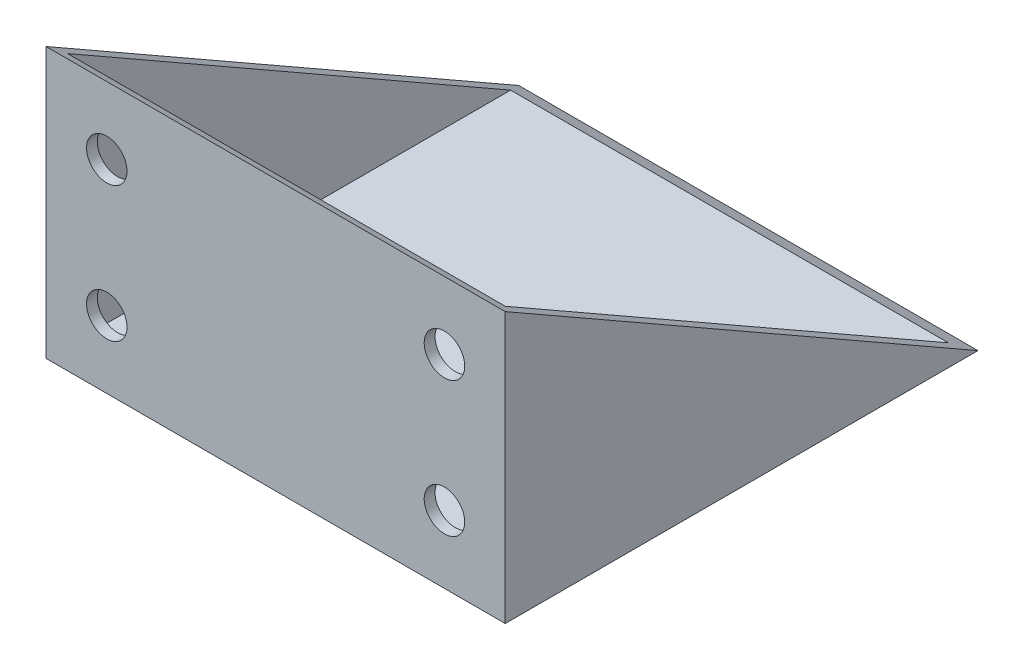
from build123d import *

# Parameters (mm, degrees)
SALIENTE_EXTRUIR3_DEPTH = 34
VACIADO5_T              = -0.8
CROQUIS5_R              = 1.5
CORTAR_EXTRUIR1_DEPTH   = 3


with BuildPart() as part:
    # Croquis4 → Saliente-Extruir3 (new body)
    with BuildSketch(Plane(origin=(0, 0, 0), x_dir=(0, 0, -1), z_dir=(1, 0, 0))):
        Polygon((0, 0), (35, 0), (0, 20), align=None)
    extrude(amount=SALIENTE_EXTRUIR3_DEPTH)

    # Vaciado5
    vaciado5_openings = [part.faces().sort_by_distance(p)[0] for p in [
        (17, 10, -17.5),
    ]]
    offset(amount=VACIADO5_T, openings=vaciado5_openings, kind=Kind.INTERSECTION)

    # Croquis5 → Cortar-Extruir1 (cut)
    with BuildSketch(Plane.XY):
        with Locations((4.5, 15)):
            Circle(CROQUIS5_R)
        with Locations((29.5, 15)):
            Circle(CROQUIS5_R)
        with Locations((29.5, 5)):
            Circle(CROQUIS5_R)
        with Locations((4.5, 5)):
            Circle(CROQUIS5_R)
    extrude(amount=-CORTAR_EXTRUIR1_DEPTH, mode=Mode.SUBTRACT)


solid = part.part
